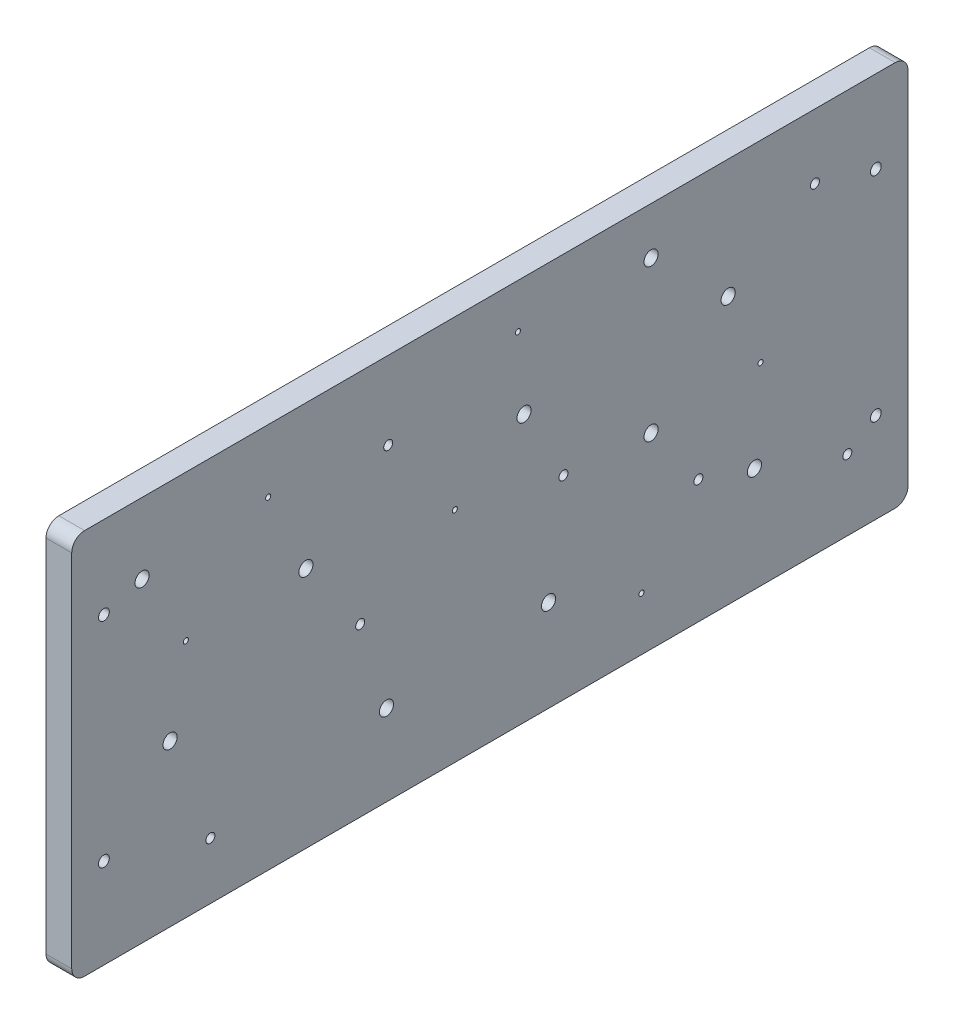
from build123d import *

# Parameters (mm, degrees)
SKETCH1_W                  = 650
SKETCH1_H                  = 300
BOSS_EXTRUDE1_DEPTH        = 20
FILLET1_R                  = 10
F_11_0_11_DIAMETER_HOLE1_D = 11
F_7_0_7_DIAMETER_HOLE2_D   = 7
F_4_0_4_DIAMETER_HOLE1_D   = 4
M8_CLEARANCE_HOLE1_D       = 8.4


with BuildPart() as part:
    # Sketch1 → Boss-Extrude1 (new body)
    with BuildSketch(Plane(origin=(0, 0, 0), x_dir=(0, 0, -1), z_dir=(1, 0, 0))):
        with Locations((325, 150)):
            Rectangle(SKETCH1_W, SKETCH1_H)
    extrude(amount=BOSS_EXTRUDE1_DEPTH)

    # Fillet1
    fillet1_edges = [part.edges().sort_by_distance(p)[0] for p in [
        (10, 300, 0),
        (10, 300, -650),
        (10, 0, -650),
        (10, 0, 0),
    ]]
    fillet(fillet1_edges, radius=FILLET1_R)

    # Ø11.0 (11) Diameter Hole1 (through all)
    with Locations(Plane(origin=(20, 0, 0), x_dir=(0, 0, -1), z_dir=(1, 0, 0))):
        with Locations((54.646833709, 244.998152891), (530.659083677, 81.560470498), (510.229373378, 207.543684009), (244.64313949, 63.173731229), (181.992027906, 188.475954397), (351.558623389, 207.543684009), (370.626353001, 71.345615349), (76.438524695, 125.143852469), (450.302223168, 145.573562769), (450.302223168, 263.38489216)):
            Hole(F_11_0_11_DIAMETER_HOLE1_D / 2)

    # Ø7.0 (7) Diameter Hole2 (through all)
    with Locations(Plane(origin=(20, 0, 0), x_dir=(0, 0, -1), z_dir=(1, 0, 0))):
        with Locations((107.764080486, 44.106001616), (224.213429191, 129.910784873), (246.005120177, 239.550230144), (487.075701706, 95.861267707), (382.203188837, 151.021485515), (577.647417365, 249.765085294), (602.844060068, 55.001847109)):
            Hole(F_7_0_7_DIAMETER_HOLE2_D / 2)

    # Ø4.0 (4) Diameter Hole1 (through all)
    with Locations(Plane(origin=(20, 0, 0), x_dir=(0, 0, -1), z_dir=(1, 0, 0))):
        with Locations((152.709443144, 251.12706598), (88.696350874, 186.432983367), (297.760386268, 170.089215127), (346.791690986, 265.42786319), (535.426016081, 150.340495172), (442.811329391, 41.382040243)):
            Hole(F_4_0_4_DIAMETER_HOLE1_D / 2)

    # M8 Clearance Hole1 (through all)
    with Locations(Plane.ZY):
        with Locations((-625, 235.86), (-625, 70), (-25, 70), (-25, 235.86)):
            Hole(M8_CLEARANCE_HOLE1_D / 2)


solid = part.part
